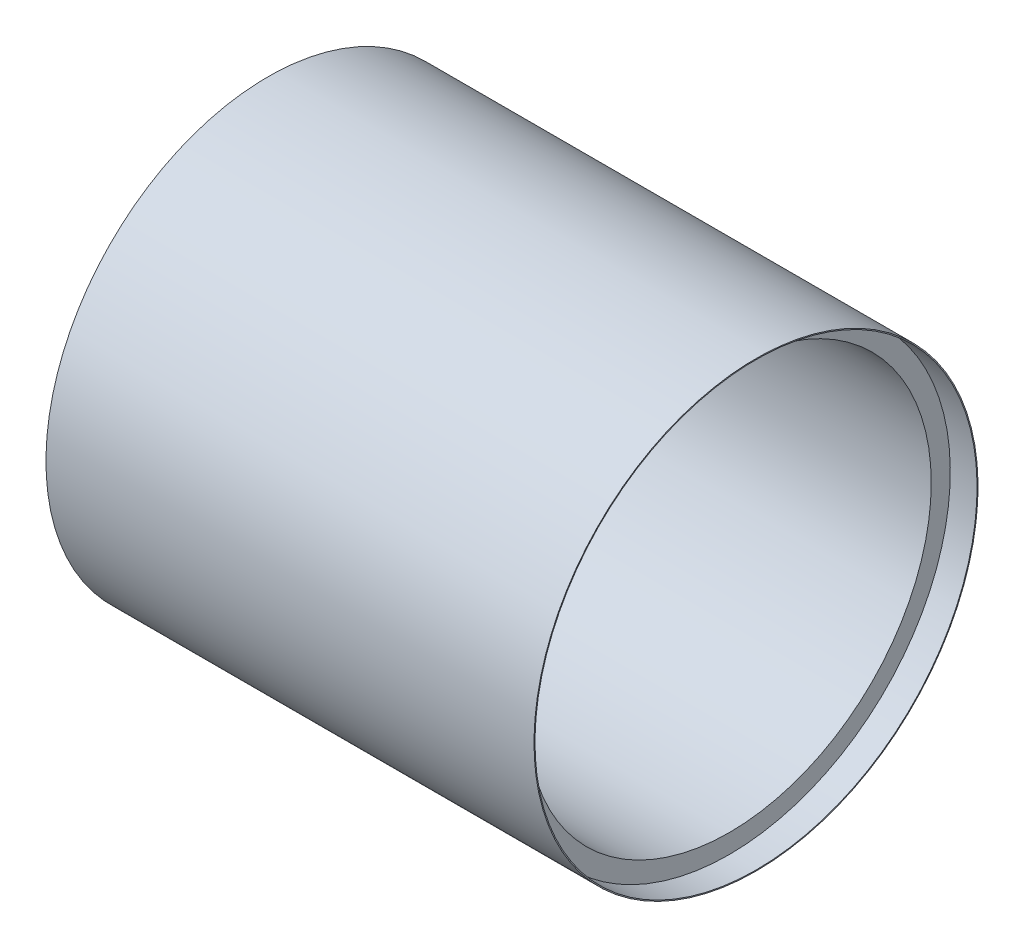
from build123d import *


with BuildPart() as part:
    # Sketch1 → Revolve1 (revolve)
    with BuildSketch(Plane.XY, mode=Mode.PRIVATE) as revolve1_sk:
        Polygon((39.146309032, 83.9724), (49.306309032, 83.9724), (49.306309032, 76.7334), (214.406309032, 76.7334), (214.406309032, 83.9724), (224.566309032, 83.9724), (224.566309032, 84.3534), (39.146309032, 84.3534), align=None)
    revolve(revolve1_sk.sketch.rotate(Axis((0, 0, 0), (1, 0, 0)), 180), axis=Axis((0, 0, 0), (1, 0, 0)))


solid = part.part
